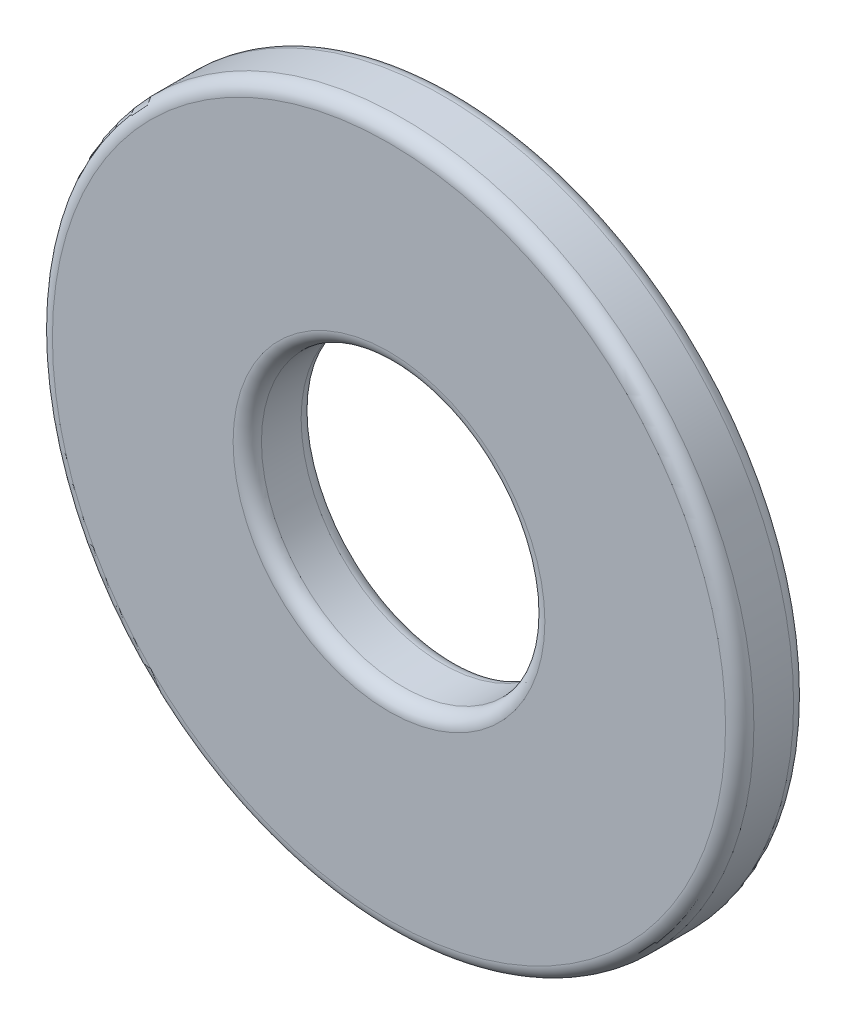
from build123d import *

# Parameters (mm, degrees)
ESBO_O1_R                = 4.95
ESBO_O1_R_2              = 2
RESSALTO_EXTRUS_O1_DEPTH = 0.96
FILETE1_R                = 0.2


with BuildPart() as part:
    # Esboço1 → Ressalto-extrusão1 (new body)
    with BuildSketch(Plane.XY):
        Circle(ESBO_O1_R)
        Circle(ESBO_O1_R_2, mode=Mode.SUBTRACT)
    extrude(amount=RESSALTO_EXTRUS_O1_DEPTH)

    # Filete1
    filete1_edges = [part.edges().sort_by_distance(p)[0] for p in [
        (-4.95, 0, 0),
        (-4.95, 0, 0.96),
        (-2, 0, 0),
        (-2, 0, 0.96),
    ]]
    fillet(filete1_edges, radius=FILETE1_R)


solid = part.part
